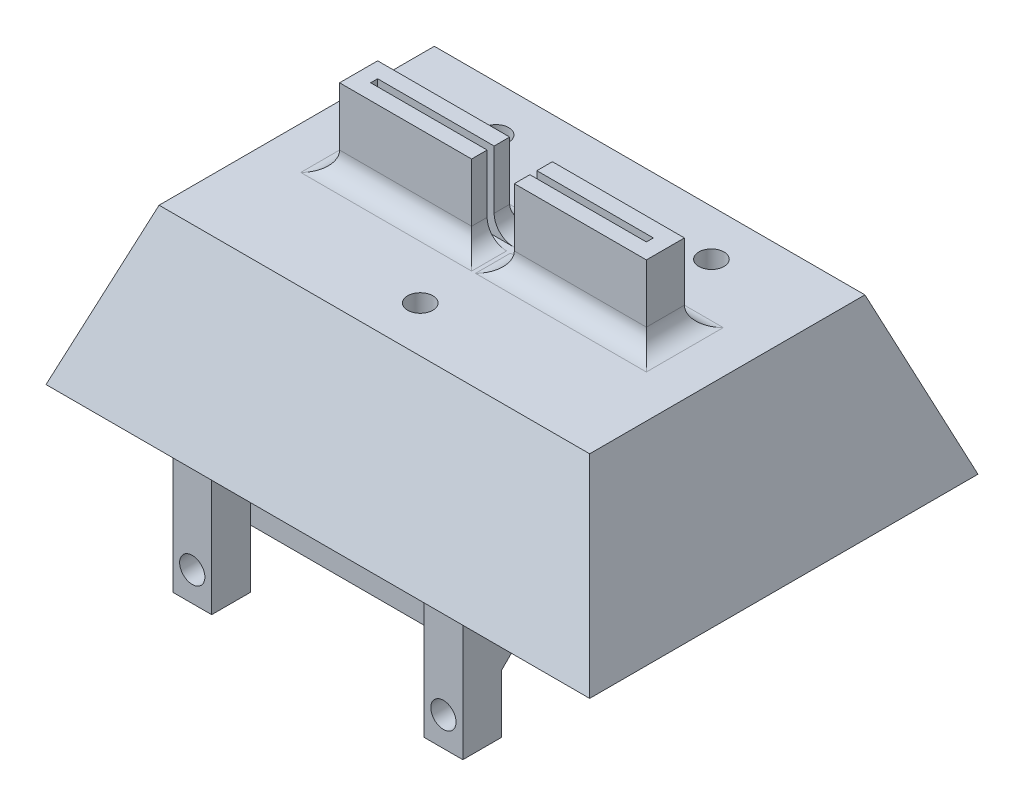
from build123d import *

# Parameters (mm, degrees)
SKETCH1_W                                    = 140
SKETCH1_H                                    = 100
BOSS_EXTRUDE2_DEPTH                          = 40
BOSS_EXTRUDE2_TAPER                          = 20
SHELL1_T                                     = -5
BOSS_EXTRUDE3_REACH                          = 96.868
SKETCH4_W                                    = 10
SKETCH4_H                                    = 89.358222276
SKETCH8_W                                    = 10
SKETCH8_H                                    = 10
BOSS_EXTRUDE4_DEPTH                          = 30
BOSS_EXTRUDE5_REACH                          = 126.987
BOSS_EXTRUDE6_DEPTH                          = 20
SKETCH13_R                                   = 3.25
CUT_EXTRUDE2_DEPTH                           = 129.840987391
SKETCH14_R                                   = 3.25
CUT_EXTRUDE3_DEPTH                           = 111.905365172
FILLET1_R                                    = 5
CSK_FOR_M4_COUNTERSUNK_FLAT_HEAD_SCR_2_COUNT = 2
CSK_FOR_M4_COUNTERSUNK_FLAT_HEAD_SCR_2_PITCH = 64.679111138


with BuildPart() as part:
    # Sketch1 → Boss-Extrude2 (new body)
    with BuildSketch(Plane(origin=(0, 0, 0), x_dir=(1, 0, 0), z_dir=(0, 1, 0))):
        Rectangle(SKETCH1_W, SKETCH1_H)
    extrude(amount=BOSS_EXTRUDE2_DEPTH, taper=BOSS_EXTRUDE2_TAPER)

    # Shell1
    shell1_openings = [part.faces().sort_by_distance(p)[0] for p in [
        (0, 0, 0),
    ]]
    offset(amount=SHELL1_T, openings=shell1_openings, kind=Kind.INTERSECTION)


with BuildPart() as body_2:

    # Sketch4 → Boss-Extrude3 (new, up to next)
    with BuildSketch(Plane.XZ, mode=Mode.PRIVATE) as boss_extrude3_sk1:
        with Locations((-32.339555569, 0)):
            Rectangle(SKETCH4_W, SKETCH4_H)
    boss_extrude3_tool1 = extrude(boss_extrude3_sk1.sketch, amount=-BOSS_EXTRUDE3_REACH, mode=Mode.PRIVATE) - part.part
    # Sketch4 → Boss-Extrude3 (new, up to next)
    with BuildSketch(Plane.XZ, mode=Mode.PRIVATE) as boss_extrude3_sk2:
        with Locations((32.339555569, 0)):
            Rectangle(SKETCH4_W, SKETCH4_H)
    boss_extrude3_tool2 = extrude(boss_extrude3_sk2.sketch, amount=-BOSS_EXTRUDE3_REACH, mode=Mode.PRIVATE) - part.part
    # Sketch4 → Boss-Extrude3 (new, up to next)
    with BuildSketch(Plane.XZ, mode=Mode.PRIVATE) as boss_extrude3_sk3:
        Rectangle(SKETCH4_W, SKETCH4_H)
    boss_extrude3_tool3 = extrude(boss_extrude3_sk3.sketch, amount=-BOSS_EXTRUDE3_REACH, mode=Mode.PRIVATE) - part.part
    add(boss_extrude3_tool1.solids().sort_by_distance((-32.339556, 0, 0))[0])
    add(boss_extrude3_tool2.solids().sort_by_distance((32.339556, 0, 0))[0])
    add(boss_extrude3_tool3.solids().sort_by_distance((0, 0, 0))[0])


with BuildPart() as part_1:
    add(part.part)

    # Sketch8 → Boss-Extrude4 (add)
    with BuildSketch(Plane.XZ):
        with Locations((-32.339555569, 45)):
            Rectangle(SKETCH8_W, SKETCH8_H)
        with Locations((32.339555569, 45)):
            Rectangle(SKETCH8_W, SKETCH8_H)
    extrude(amount=BOSS_EXTRUDE4_DEPTH)

    # Boss-Extrude5: up to this face of the body (flat: up to its plane)
    boss_extrude5_end = Plane(body_2.part.faces().sort_by_distance((-37.339555569, 16.530131779, 0))[0])
    # Sketch9 → Boss-Extrude5 (add, up to the picked face)
    with BuildSketch(Plane(origin=(37.339555569, 0, 0), x_dir=(0, 0, -1), z_dir=(1, 0, 0)), mode=Mode.PRIVATE) as boss_extrude5_sk1:
        Polygon((-40, -15), (-25, 0), (-30, 0), (-40, -10), align=None)
    boss_extrude5_tool1 = split(extrude(boss_extrude5_sk1.sketch, amount=-BOSS_EXTRUDE5_REACH, mode=Mode.PRIVATE), bisect_by=boss_extrude5_end, keep=Keep.BOTH, mode=Mode.PRIVATE)
    add(boss_extrude5_tool1.solids().sort_by(Axis((37.339556, -6.333333, 33.666667), (-1, 0, 0)))[0])

    # Sketch12 → Boss-Extrude6 (add)
    with BuildSketch(Plane(origin=(0, 40, 0), x_dir=(1, 0, 0), z_dir=(0, 1, 0))):
        Polygon((-35.5, -0.9), (-35.5, 0.9), (-5.5, 0.9), (-5.5, 4.9), (-33.433278652, 4.9), (-39.5, 4.9), (-39.5, -4.9), (-35.5, -4.9), (-5.5, -4.9), (-5.5, -0.9), align=None)
        Polygon((39.5, 4.9), (39.5, -4.9), (35.5, -4.9), (5.5, -4.9), (5.5, -0.9), (35.5, -0.9), (35.5, 0.9), (5.5, 0.9), (5.5, 4.9), (33.433278652, 4.9), align=None)
    extrude(amount=BOSS_EXTRUDE6_DEPTH)

    # Sketch13 → Cut-Extrude2 (cut, through all)
    with BuildSketch(Plane(origin=(0, 0, 40), x_dir=(-1, 0, 0), z_dir=(0, 0, -1))):
        with Locations((-32.339555569, -22.5)):
            Circle(SKETCH13_R)
        with Locations(Location((32.339555569, -22.5, 0), (0, 0, 180))):
            Circle(SKETCH13_R)
    extrude(amount=-CUT_EXTRUDE2_DEPTH, mode=Mode.SUBTRACT)


with BuildPart() as cut_extrude3_tool:
    # Sketch14 → Cut-Extrude3 (new, through all)
    with BuildSketch(Plane(origin=(0, 40, 0), x_dir=(1, 0, 0), z_dir=(0, 1, 0))):
        with Locations(Location((-27.721190629, 23.631190629, 0), (0, 0, 270))):
            Circle(SKETCH14_R)
        with Locations(Location((27.721190629, 23.631190629, 0), (0, 0, 270))):
            Circle(SKETCH14_R)
        with BuildLine():
            ThreePointArc((3.25, -23.631190629), (2.298097039, -21.33309359), (0, -20.381190629))
            Line((0, -20.381190629), (0, -26.881190629))
            ThreePointArc((0, -26.881190629), (2.298097039, -25.929287668), (3.25, -23.631190629))
        make_face()
        with BuildLine():
            Line((0, -26.881190629), (0, -20.381190629))
            ThreePointArc((0, -20.381190629), (-3.25, -23.631190629), (0, -26.881190629))
        make_face()
    extrude(amount=-CUT_EXTRUDE3_DEPTH)


with BuildPart() as part_2:
    add(part_1.part)

    # Cut-Extrude3: cut by cut_extrude3_tool
    add(cut_extrude3_tool.part, mode=Mode.SUBTRACT)

    # Fillet1
    fillet1_edges = [part_2.edges().sort_by_distance(p)[0] for p in [
        (22.5, 40, -4.9),
        (5.5, 40, -2.9),
        (5.5, 40, 2.9),
        (22.5, 40, 4.9),
        (39.5, 40, 0),
        (-5.5, 40, 2.9),
        (-5.5, 40, -2.9),
        (-22.5, 40, -4.9),
        (-39.5, 40, 0),
        (-22.5, 40, 4.9),
    ]]
    fillet(fillet1_edges, radius=FILLET1_R)

    # Sketch15 → CSK for M4 Countersunk Flat Head Screw1 (revolve, cut)
    with BuildSketch(Plane(origin=(32.339555569, -22.5, 40), x_dir=(0, 1, 0), z_dir=(1, 0, 0))):
        Polygon((0, 0), (0, 11.351936393), (2.25, 10), (2.25, 2.45), (4.7, 0), align=None)
    csk_for_m4_countersunk_flat_head_screw1 = revolve(axis=Axis((32.339555569, -22.5, 33.65), (0, 0, 1)), mode=Mode.SUBTRACT)

    # CSK for M4 Countersunk Flat Head Scr 2: CSK for M4 Countersunk Flat Head Screw1 ×2
    with Locations(*[(-i * CSK_FOR_M4_COUNTERSUNK_FLAT_HEAD_SCR_2_PITCH, 0, 0) for i in range(1, CSK_FOR_M4_COUNTERSUNK_FLAT_HEAD_SCR_2_COUNT)]):
        add(csk_for_m4_countersunk_flat_head_screw1, mode=Mode.SUBTRACT)


with BuildPart() as body_2_1:
    add(body_2.part)

    # Cut-Extrude3: cut by cut_extrude3_tool
    add(cut_extrude3_tool.part, mode=Mode.SUBTRACT)


solid = Compound([part_2.part, body_2_1.part])
